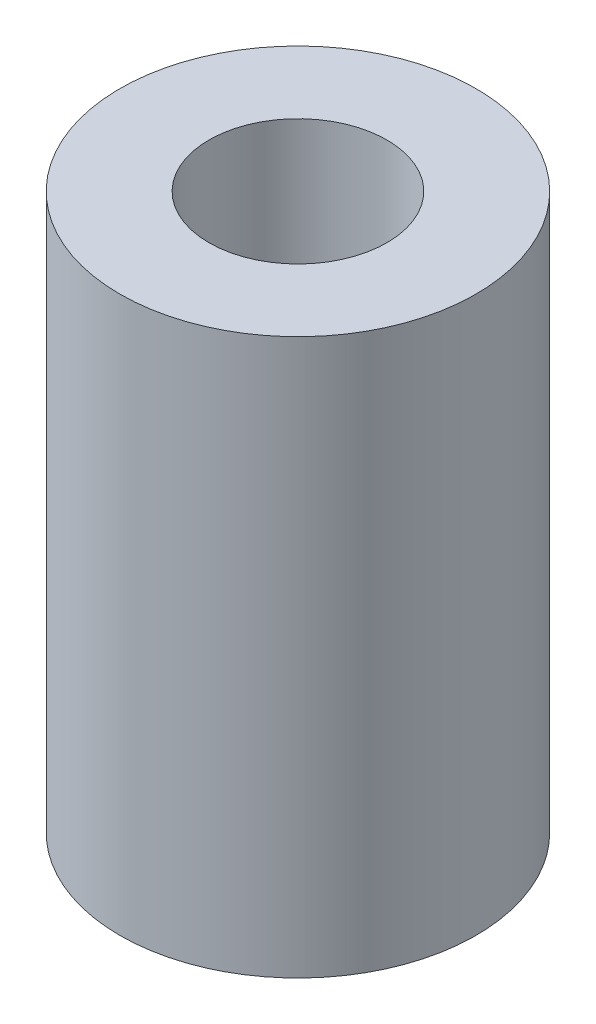
from build123d import *

# Parameters (mm, degrees)
SKETCH1_R           = 6.35
SKETCH1_R_2         = 3.175
BOSS_EXTRUDE1_DEPTH = 19.812


with BuildPart() as part:
    # Sketch1 → Boss-Extrude1 (new body)
    with BuildSketch(Plane(origin=(0, 0, 0), x_dir=(1, 0, 0), z_dir=(0, 1, 0))):
        with Locations(Location((0, 0, 0), (0, 0, 270))):
            Circle(SKETCH1_R)
        with Locations(Location((0, 0, 0), (0, 0, 270))):
            Circle(SKETCH1_R_2, mode=Mode.SUBTRACT)
    extrude(amount=BOSS_EXTRUDE1_DEPTH)


solid = part.part
